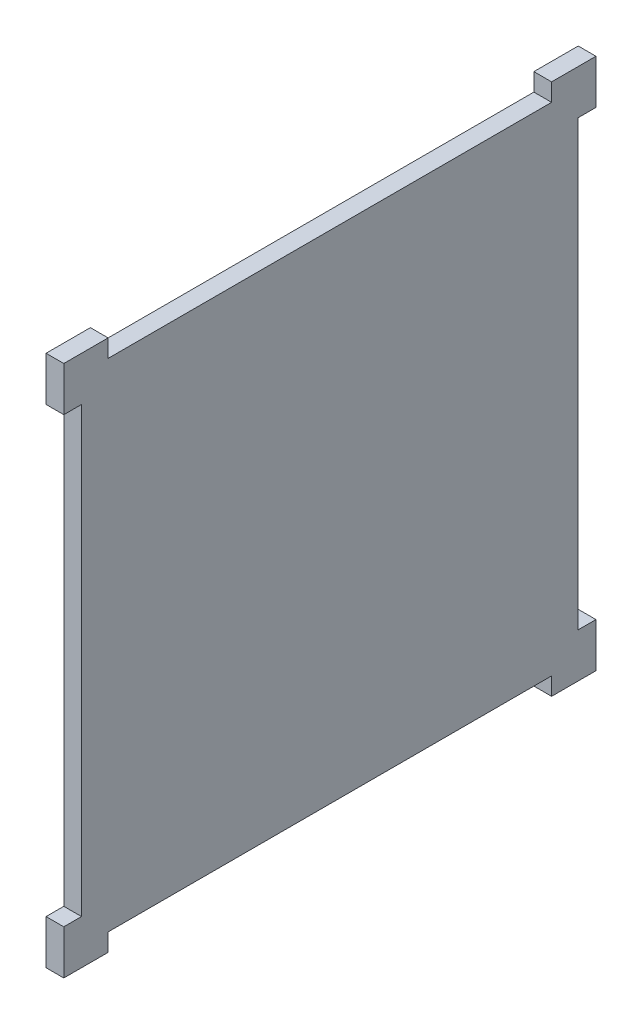
from build123d import *

# Parameters (mm, degrees)
BOSS_EXTRUDE1_DEPTH = 5.08


with BuildPart() as part:
    # Sketch1 → Boss-Extrude1 (new body)
    with BuildSketch(Plane(origin=(0, 0, 0), x_dir=(0, 0, -1), z_dir=(1, 0, 0))):
        Polygon((-63.5, 71.12), (63.5, 71.12), (63.5, 76.2), (76.2, 76.2), (76.2, 63.5), (71.12, 63.5), (71.12, -63.5), (76.2, -63.5), (76.2, -76.2), (63.5, -76.2), (63.5, -71.12), (-63.5, -71.12), (-63.5, -76.2), (-76.2, -76.2), (-76.2, -63.5), (-71.12, -63.5), (-71.12, 63.5), (-76.2, 63.5), (-76.2, 76.2), (-63.5, 76.2), align=None)
    extrude(amount=BOSS_EXTRUDE1_DEPTH)


solid = part.part
